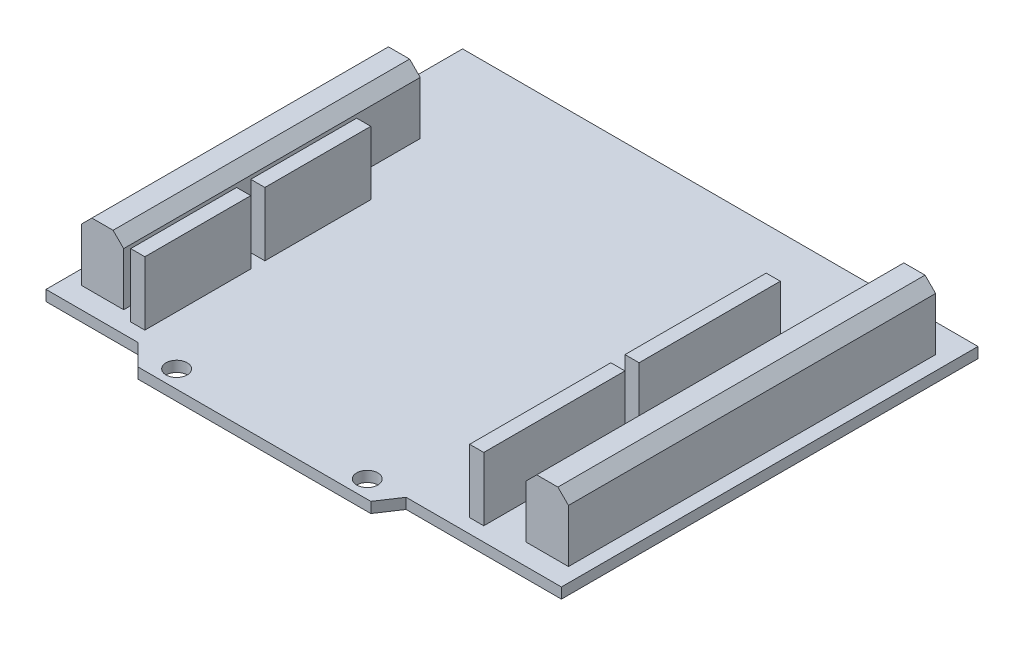
from build123d import *

# Parameters (mm, degrees)
SKETCH1_W           = 73
SKETCH1_H           = 62
BOSS_EXTRUDE1_DEPTH = 0.75
CUT_EXTRUDE1_DEPTH  = 2
SKETCH3_R           = 1.5
CUT_EXTRUDE2_DEPTH  = 2
SKETCH4_W           = 6
SKETCH4_H           = 42
SKETCH4_H_2         = 52
SKETCH4_W_2         = 2
SKETCH4_H_3         = 15
SKETCH4_H_4         = 20
BOSS_EXTRUDE2_DEPTH = 9
CHAMFER1_SIZE       = 1.5
SKETCH5_W           = 2
SKETCH5_H           = 15
BOSS_EXTRUDE3_DEPTH = 2
SKETCH6_W           = 2
SKETCH6_H           = 20
BOSS_EXTRUDE4_DEPTH = 2


with BuildPart() as part:
    # Sketch1 → Boss-Extrude1 (new, symmetric)
    with BuildSketch(Plane(origin=(0, 0, 0), x_dir=(1, 0, 0), z_dir=(0, 1, 0))):
        Rectangle(SKETCH1_W, SKETCH1_H)
    extrude(amount=BOSS_EXTRUDE1_DEPTH, both=True)

    # Sketch2 → Cut-Extrude1 (cut)
    with BuildSketch(Plane(origin=(0, 0.75, 0), x_dir=(1, 0, 0), z_dir=(0, 1, 0))):
        Polygon((-36.5, -31), (-36.5, -28), (-23.5, -28), (-20.5, -31), align=None)
        Polygon((36.5, -31), (12.5, -31), (14.5, -28), (36.5, -28), align=None)
    extrude(amount=-CUT_EXTRUDE1_DEPTH, mode=Mode.SUBTRACT)

    # Sketch3 → Cut-Extrude2 (cut)
    with BuildSketch(Plane(origin=(0, 0.75, 0), x_dir=(1, 0, 0), z_dir=(0, 1, 0))):
        with Locations(Location((-17.5, -28.5, 0), (0, 0, 270))):
            Circle(SKETCH3_R)
        with Locations(Location((9.5, -28.5, 0), (0, 0, 90))):
            Circle(SKETCH3_R)
        with Locations(Location((24.5, 22, 0), (0, 0, 270))):
            Circle(SKETCH3_R)
    extrude(amount=-CUT_EXTRUDE2_DEPTH, mode=Mode.SUBTRACT)

    # Sketch4 → Boss-Extrude2 (add)
    with BuildSketch(Plane(origin=(0, 0.75, 0), x_dir=(1, 0, 0), z_dir=(0, 1, 0))):
        with Locations((-31.5, -4)):
            Rectangle(SKETCH4_W, SKETCH4_H)
        with Locations((31.5, 1)):
            Rectangle(SKETCH4_W, SKETCH4_H_2)
        with Locations((-25.5, -1.5)):
            Rectangle(SKETCH4_W_2, SKETCH4_H_3)
        with Locations((-25.5, -18.5)):
            Rectangle(SKETCH4_W_2, SKETCH4_H_3)
        with Locations((22.5, 6)):
            Rectangle(SKETCH4_W_2, SKETCH4_H_4)
        with Locations((22.5, -16)):
            Rectangle(SKETCH4_W_2, SKETCH4_H_4)
    extrude(amount=BOSS_EXTRUDE2_DEPTH)

    # Chamfer1
    chamfer1_edges = [part.edges().sort_by_distance(p)[0] for p in [
        (-34.5, 9.75, 4),
        (-28.5, 9.75, 4),
        (34.5, 9.75, -1),
        (28.5, 9.75, -1),
    ]]
    chamfer(chamfer1_edges, length=CHAMFER1_SIZE)

    # Sketch5 → Boss-Extrude3 (add)
    with BuildSketch(Plane.XZ.offset(0.75)):
        with Locations((-23.5, 18.5)):
            Rectangle(SKETCH5_W, SKETCH5_H)
        with Locations((-23.5, 1.5)):
            Rectangle(SKETCH5_W, SKETCH5_H)
    extrude(amount=BOSS_EXTRUDE3_DEPTH)

    # Sketch6 → Boss-Extrude4 (add)
    with BuildSketch(Plane.XZ.offset(0.75)):
        with Locations((24.5, 16)):
            Rectangle(SKETCH6_W, SKETCH6_H)
        with Locations((24.5, -6)):
            Rectangle(SKETCH6_W, SKETCH6_H)
    extrude(amount=BOSS_EXTRUDE4_DEPTH)


solid = part.part
